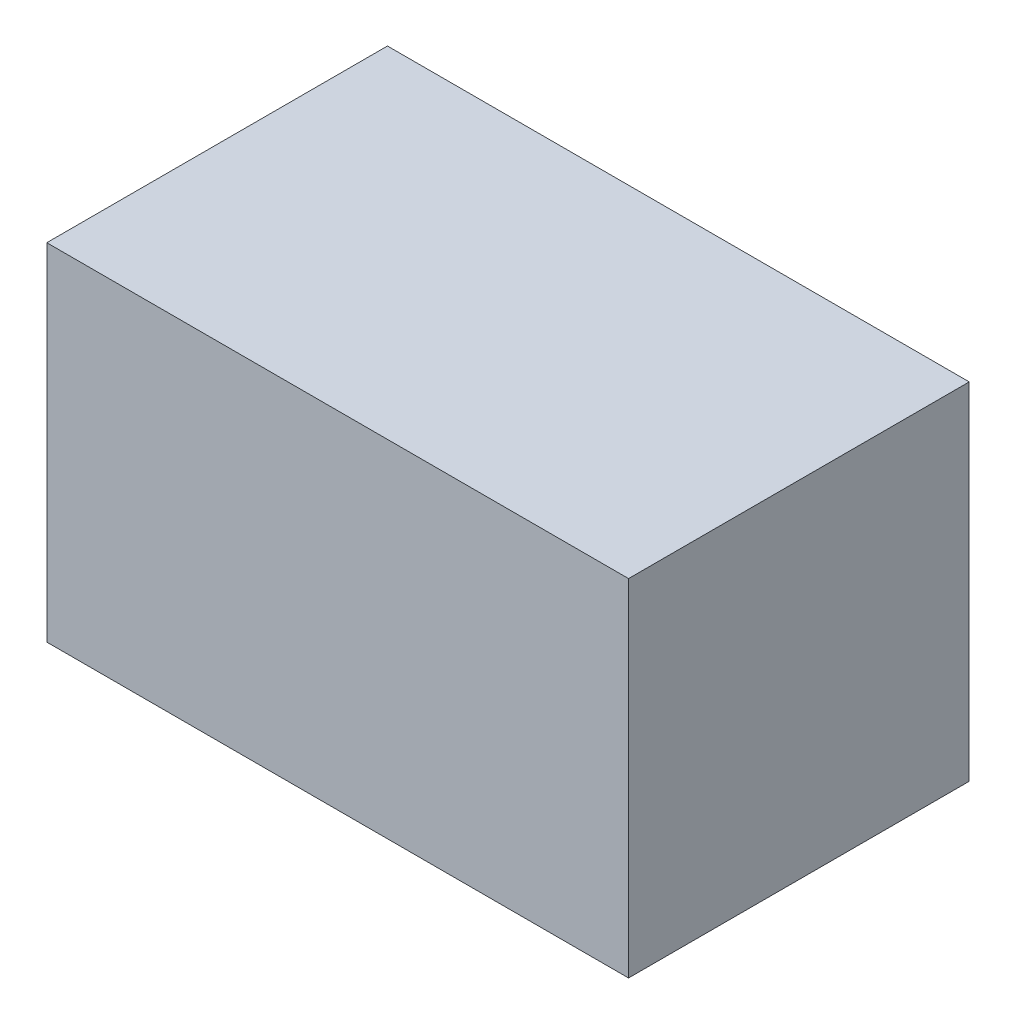
from build123d import *

# Parameters (mm, degrees)
SKETCH_1_W      = 111
SKETCH_1_H      = 65
EXTRUDE_1_DEPTH = 66


with BuildPart() as part:
    # Эскиз1 → Бобышка-Вытянуть1 (new body)
    with BuildSketch(Plane(origin=(0, 0, 0), x_dir=(1, 0, 0), z_dir=(0, 1, 0))):
        Rectangle(SKETCH_1_W, SKETCH_1_H)
    extrude(amount=EXTRUDE_1_DEPTH)


solid = part.part
